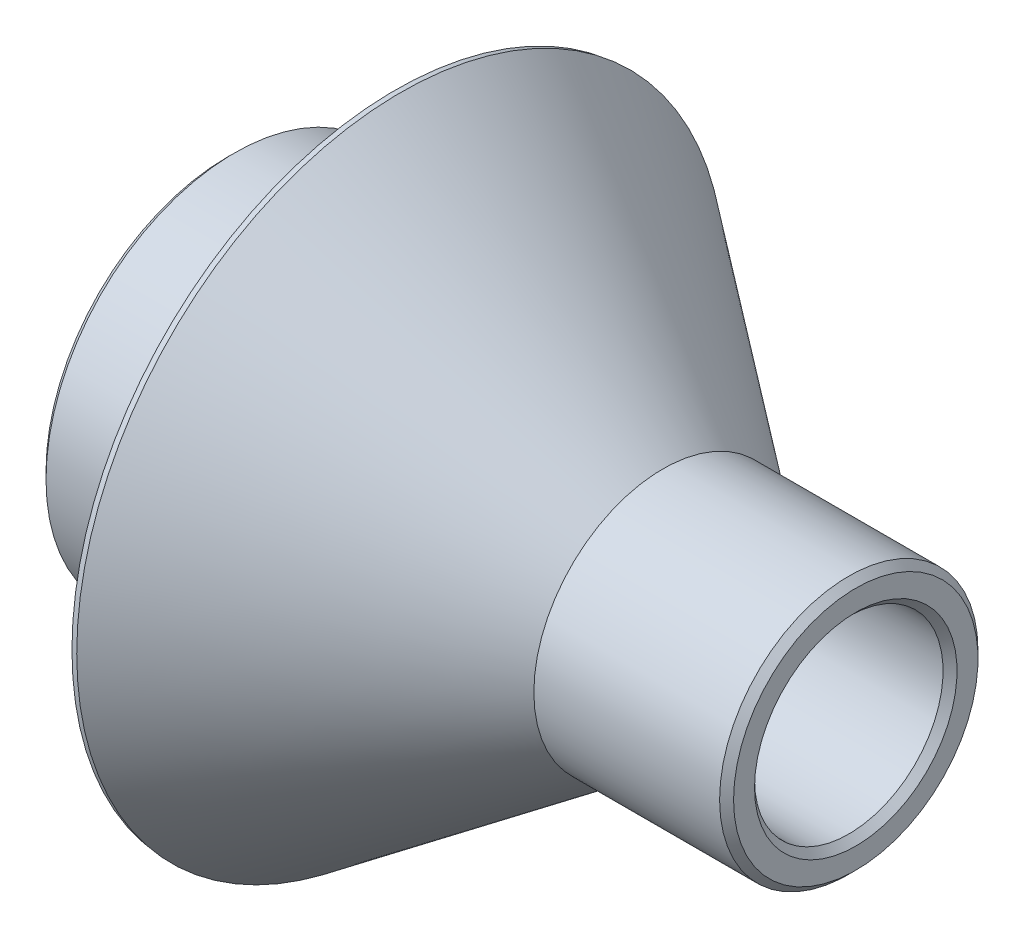
from build123d import *
from OCP.BRepFilletAPI import BRepFilletAPI_MakeChamfer

# Parameters (mm, degrees)
SKETCH1_W          = 6.096
SKETCH1_H          = 6.858
SKETCH2_R          = 3.429
CUT_EXTRUDE1_DEPTH = 29.408287616
CHAMFER1_SIZE      = 0.254
CHAMFER1_SIZE2     = 0.181544311


with BuildPart() as part:
    # Sketch1 → Revolve1 (revolve)
    with BuildSketch(Plane.XY, mode=Mode.PRIVATE) as revolve1_sk:
        with Locations((3.048, 3.429)):
            Rectangle(SKETCH1_W, SKETCH1_H)
        Polygon((6.096, 6.858), (6.096, 0), (15.8369, 0), (15.8369, 4.699), (6.096, 11.938), align=None)
        Polygon((15.8369, 4.699), (15.8369, 0), (17.1069, 0), (18.6182, 0), (20.1295, 0), (21.3995, 0), (22.8473, 0), (22.8473, 4.699), align=None)
    revolve(revolve1_sk.sketch.rotate(Axis((6.096, 0, 0), (1, 0, 0)), 90), axis=Axis((6.096, 0, 0), (1, 0, 0)))

    # Sketch2 → Cut-Extrude1 (cut, through all)
    with BuildSketch(Plane(origin=(22.8473, 0, 0), x_dir=(0, 0, -1), z_dir=(1, 0, 0))):
        Circle(SKETCH2_R)
    extrude(amount=-CUT_EXTRUDE1_DEPTH, mode=Mode.SUBTRACT)

    # Chamfer1: one chamfer whose edges measure the first distance from different faces: ONE call of the kernel's chamfer builder (chamfer() names one face for all edges)
    chamfer1_edges_1 = [part.edges().sort_by_distance(p)[0] for p in [
        (0, 0, -6.858),
        (0, 0, 3.429),
        (22.8473, 0, 3.429),
        (22.8473, 0, -4.699),
    ]]
    chamfer1_edges_2 = [part.edges().sort_by_distance(p)[0] for p in [
        (6.096, 0, -11.938),
    ]]
    chamfer1_side_2 = [part.faces().sort_by_distance(p)[0] for p in [
        (10.96645, 0, -8.3185),
    ]]
    chamfer1 = BRepFilletAPI_MakeChamfer(part.part.solid().wrapped)
    for e in chamfer1_edges_1:
        chamfer1.Add(CHAMFER1_SIZE, e.wrapped)
    for e in chamfer1_edges_2:
        chamfer1.Add(CHAMFER1_SIZE, CHAMFER1_SIZE2, e.wrapped, chamfer1_side_2[0].wrapped)  # the first distance lies on this face
    add(Compound.cast(chamfer1.Shape()), mode=Mode.REPLACE)


solid = part.part
